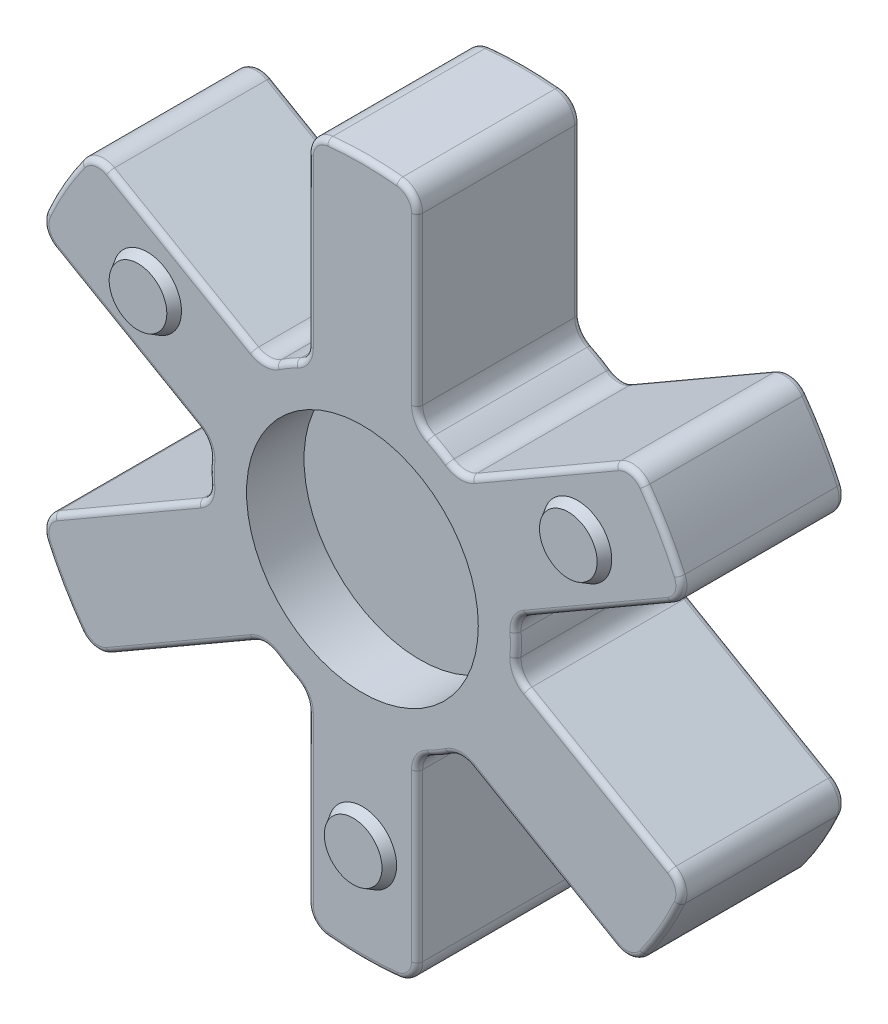
from build123d import *

# Parameters (mm, degrees)
BOSS_EXTRUDE1_DEPTH           = 11.176
CIRPATTERN1_COUNT             = 6
SKETCH4_R                     = 4.683125
BOSS_EXTRUDE2_DEPTH           = 1.27
BOSS_EXTRUDE2_DRAFT           = 30
BOSS_EXTRUDE2_PROFILE_2_DEPTH = 1.27
BOSS_EXTRUDE2_PROFILE_2_DRAFT = 30
BOSS_EXTRUDE2_PROFILE_3_DEPTH = 1.27
BOSS_EXTRUDE2_PROFILE_3_DRAFT = 30
FILLET3_R                     = 2.9972
SKETCH5_R                     = 15.875
CUT_EXTRUDE1_DEPTH            = 7.874
FILLET2_R                     = 0.762


with BuildPart() as part:
    # Sketch3 → Boss-Extrude1 (new body)
    with BuildSketch(Plane.XY):
        with BuildLine():
            Line((-7.493, 47.031857033), (-7.493, 19.654513035))
            ThreePointArc((-7.493, 19.654513035), (-9.033760313, 18.995686517), (-10.5171875, 18.216303103))
            Line((-10.5171875, 18.216303103), (0, 0))
            Line((0, 0), (10.5171875, 18.216303103))
            ThreePointArc((10.5171875, 18.216303103), (9.033760313, 18.995686517), (7.493, 19.654513035))
            Line((7.493, 19.654513035), (7.493, 47.031857033))
            ThreePointArc((7.493, 47.031857033), (0, 47.625), (-7.493, 47.031857033))
        make_face()
    extrude(amount=BOSS_EXTRUDE1_DEPTH)


with BuildPart() as cirpattern1_1:
    # CirPattern1: pattern copy
    add(part.part.rotate(Axis((0, 0, 0), (0, 0, 1)), 1 * 360 / CIRPATTERN1_COUNT))


with BuildPart() as cirpattern1_2:
    # CirPattern1: pattern copy
    add(part.part.rotate(Axis((0, 0, 0), (0, 0, 1)), 2 * 360 / CIRPATTERN1_COUNT))


with BuildPart() as cirpattern1_3:
    # CirPattern1: pattern copy
    add(part.part.rotate(Axis((0, 0, 0), (0, 0, 1)), 3 * 360 / CIRPATTERN1_COUNT))


with BuildPart() as cirpattern1_4:
    # CirPattern1: pattern copy
    add(part.part.rotate(Axis((0, 0, 0), (0, 0, 1)), 4 * 360 / CIRPATTERN1_COUNT))


with BuildPart() as cirpattern1_5:
    # CirPattern1: pattern copy
    add(part.part.rotate(Axis((0, 0, 0), (0, 0, 1)), 5 * 360 / CIRPATTERN1_COUNT))


with BuildPart() as cirpattern1_1_1:
    add(cirpattern1_1.part)

    # Combine1: union part, CirPattern1_5, CirPattern1_4, CirPattern1_3, CirPattern1_2
    add(part.part)
    add(cirpattern1_5.part)
    add(cirpattern1_4.part)
    add(cirpattern1_3.part)
    add(cirpattern1_2.part)


with BuildPart() as boss_extrude2_tool:
    # Sketch4 → Boss-Extrude2 (with draft: the straight prism first)
    with BuildSketch(Plane.XY.offset(11.176)):
        with Locations((-29.47354304, 17.016558008)):
            Circle(SKETCH4_R)
    extrude(amount=BOSS_EXTRUDE2_DEPTH)
    # Boss-Extrude2: the draft: its side faces are tilted about the plane it starts from
    boss_extrude2_sides = [boss_extrude2_tool.faces().sort_by_distance(p)[0] for p in [
        (-34.15666804, 17.016558008, 11.811),
    ]]
    draft(boss_extrude2_sides, Plane.XY.offset(11.176), BOSS_EXTRUDE2_DRAFT)


with BuildPart() as cirpattern1_1_2:
    add(cirpattern1_1_1.part)

    # Boss-Extrude2: add boss_extrude2_tool
    add(boss_extrude2_tool.part)


with BuildPart() as boss_extrude2_profile_2_tool:
    # Sketch4 → Boss-Extrude2 profile 2 (with draft: the straight prism first)
    with BuildSketch(Plane.XY.offset(11.176)):
        with Locations((0, -34.033116017)):
            Circle(SKETCH4_R)
    extrude(amount=BOSS_EXTRUDE2_PROFILE_2_DEPTH)
    # Boss-Extrude2 profile 2: the draft: its side faces are tilted about the plane it starts from
    boss_extrude2_profile_2_sides = [boss_extrude2_profile_2_tool.faces().sort_by_distance(p)[0] for p in [
        (-4.683125, -34.033116017, 11.811),
    ]]
    draft(boss_extrude2_profile_2_sides, Plane.XY.offset(11.176), BOSS_EXTRUDE2_PROFILE_2_DRAFT)


with BuildPart() as cirpattern1_1_3:
    add(cirpattern1_1_2.part)

    # Boss-Extrude2 profile 2: add boss_extrude2_profile_2_tool
    add(boss_extrude2_profile_2_tool.part)


with BuildPart() as boss_extrude2_profile_3_tool:
    # Sketch4 → Boss-Extrude2 profile 3 (with draft: the straight prism first)
    with BuildSketch(Plane.XY.offset(11.176)):
        with Locations((29.47354304, 17.016558008)):
            Circle(SKETCH4_R)
    extrude(amount=BOSS_EXTRUDE2_PROFILE_3_DEPTH)
    # Boss-Extrude2 profile 3: the draft: its side faces are tilted about the plane it starts from
    boss_extrude2_profile_3_sides = [boss_extrude2_profile_3_tool.faces().sort_by_distance(p)[0] for p in [
        (24.79041804, 17.016558008, 11.811),
    ]]
    draft(boss_extrude2_profile_3_sides, Plane.XY.offset(11.176), BOSS_EXTRUDE2_PROFILE_3_DRAFT)


with BuildPart() as cirpattern1_1_4:
    add(cirpattern1_1_3.part)

    # Boss-Extrude2 profile 3: add boss_extrude2_profile_3_tool
    add(boss_extrude2_profile_3_tool.part)

    # Fillet3
    fillet3_edges = [cirpattern1_1_4.edges().sort_by_distance(p)[0] for p in [
        (-36.984282978, 30.005056867, 5.588),
        (-13.274807587, 16.316384868, 5.588),
        (-20.767807587, 3.338128167, 5.588),
        (-44.477282978, 17.026800166, 5.588),
        (7.493, 47.031857033, 5.588),
        (-7.493, 47.031857033, 5.588),
        (-7.493, 19.654513035, 5.588),
        (13.274807587, 16.316384868, 5.588),
        (7.493, 19.654513035, 5.588),
        (44.477282978, 17.026800166, 5.588),
        (36.984282978, 30.005056867, 5.588),
        (20.767807587, -3.338128167, 5.588),
        (20.767807587, 3.338128167, 5.588),
        (36.984282978, -30.005056867, 5.588),
        (44.477282978, -17.026800166, 5.588),
        (7.493, -19.654513035, 5.588),
        (13.274807587, -16.316384868, 5.588),
        (-7.493, -47.031857033, 5.588),
        (7.493, -47.031857033, 5.588),
        (-13.274807587, -16.316384868, 5.588),
        (-7.493, -19.654513035, 5.588),
        (-44.477282978, -17.026800166, 5.588),
        (-36.984282978, -30.005056867, 5.588),
        (-20.767807587, -3.338128167, 5.588),
    ]]
    fillet(fillet3_edges, radius=FILLET3_R)

    # Sketch5 → Cut-Extrude1 (cut)
    with BuildSketch(Plane.XY.offset(11.176)):
        Circle(SKETCH5_R)
    extrude(amount=-CUT_EXTRUDE1_DEPTH, mode=Mode.SUBTRACT)

    # Mirror1: CirPattern1_1 across plane


with BuildPart() as cirpattern1_1_5:
    add(cirpattern1_1_4.part)
    add(cirpattern1_1_4.part.mirror(Plane.XY))

    # Fillet2
    fillet2_edges = [cirpattern1_1_5.edges().sort_by_distance(p)[0] for p in [
        (7.493, 33.010938536, 11.176),
        (-41.244459855, 23.8125, 11.176),
        (-32.334811375, 10.016340918, 11.176),
        (-21.034375, 0, 11.176),
        (-32.334811375, -10.016340918, 11.176),
        (-41.244459855, -23.8125, 11.176),
        (-24.841811375, -22.994597619, 11.176),
        (-10.5171875, -18.216303103, 11.176),
        (-7.493, -33.010938536, 11.176),
        (0, -47.625, 11.176),
        (7.493, -33.010938536, 11.176),
        (10.5171875, -18.216303103, 11.176),
        (24.841811375, -22.994597619, 11.176),
        (41.244459855, -23.8125, 11.176),
        (32.334811375, -10.016340918, 11.176),
        (21.034375, 0, 11.176),
        (32.334811375, 10.016340918, 11.176),
        (41.244459855, 23.8125, 11.176),
        (24.841811375, 22.994597619, 11.176),
        (10.5171875, 18.216303103, 11.176),
        (-43.552359363, 17.38615192, 11.176),
        (-36.833028918, 29.024373643, 11.176),
        (36.833028918, 29.024373643, 11.176),
        (43.552359363, 17.38615192, 11.176),
        (43.552359363, -17.38615192, 11.176),
        (36.833028918, -29.024373643, 11.176),
        (6.719330445, -46.410525563, 11.176),
        (-6.719330445, -46.410525563, 11.176),
        (-36.833028918, -29.024373643, 11.176),
        (-43.552359363, -17.38615192, 11.176),
        (-6.719330445, 46.410525563, 11.176),
        (6.719330445, 46.410525563, 11.176),
        (-13.371640419, 16.900068793, 11.176),
        (-7.950068691, 20.03021469, 11.176),
        (7.950068691, 20.03021469, 11.176),
        (13.371640419, 16.900068793, 11.176),
        (-21.32170911, -3.130145896, 11.176),
        (-13.371640419, -16.900068793, 11.176),
        (-7.950068691, -20.03021469, 11.176),
        (7.950068691, -20.03021469, 11.176),
        (13.371640419, -16.900068793, 11.176),
        (21.32170911, -3.130145896, 11.176),
        (21.32170911, 3.130145896, 11.176),
        (-21.32170911, 3.130145896, 11.176),
        (-41.244459855, 23.8125, -11.176),
        (-32.334811375, 10.016340918, -11.176),
        (-21.034375, 0, -11.176),
        (-10.5171875, 18.216303103, -11.176),
        (-24.841811375, 22.994597619, -11.176),
        (0, 47.625, -11.176),
        (-7.493, 33.010938536, -11.176),
        (10.5171875, 18.216303103, -11.176),
        (7.493, 33.010938536, -11.176),
        (41.244459855, 23.8125, -11.176),
        (24.841811375, 22.994597619, -11.176),
        (21.034375, 0, -11.176),
        (32.334811375, 10.016340918, -11.176),
        (41.244459855, -23.8125, -11.176),
        (32.334811375, -10.016340918, -11.176),
        (10.5171875, -18.216303103, -11.176),
        (24.841811375, -22.994597619, -11.176),
        (0, -47.625, -11.176),
        (7.493, -33.010938536, -11.176),
        (-10.5171875, -18.216303103, -11.176),
        (-7.493, -33.010938536, -11.176),
        (-41.244459855, -23.8125, -11.176),
        (-24.841811375, -22.994597619, -11.176),
        (-32.334811375, -10.016340918, -11.176),
        (-13.371640419, 16.900068793, -11.176),
        (-7.950068691, 20.03021469, -11.176),
        (6.719330445, 46.410525563, -11.176),
        (7.950068691, 20.03021469, -11.176),
        (13.371640419, 16.900068793, -11.176),
        (-6.719330445, 46.410525563, -11.176),
        (-43.552359363, -17.38615192, -11.176),
        (-21.32170911, -3.130145896, -11.176),
        (-13.371640419, -16.900068793, -11.176),
        (-36.833028918, -29.024373643, -11.176),
        (-6.719330445, -46.410525563, -11.176),
        (-7.950068691, -20.03021469, -11.176),
        (7.950068691, -20.03021469, -11.176),
        (6.719330445, -46.410525563, -11.176),
        (36.833028918, -29.024373643, -11.176),
        (13.371640419, -16.900068793, -11.176),
        (21.32170911, -3.130145896, -11.176),
        (43.552359363, -17.38615192, -11.176),
        (43.552359363, 17.38615192, -11.176),
        (21.32170911, 3.130145896, -11.176),
        (36.833028918, 29.024373643, -11.176),
        (-36.833028918, 29.024373643, -11.176),
        (-21.32170911, 3.130145896, -11.176),
        (-43.552359363, 17.38615192, -11.176),
        (-24.841811375, 22.994597619, 11.176),
        (-10.5171875, 18.216303103, 11.176),
        (-7.493, 33.010938536, 11.176),
        (0, 47.625, 11.176),
    ]]
    fillet(fillet2_edges, radius=FILLET2_R)


solid = cirpattern1_1_5.part
